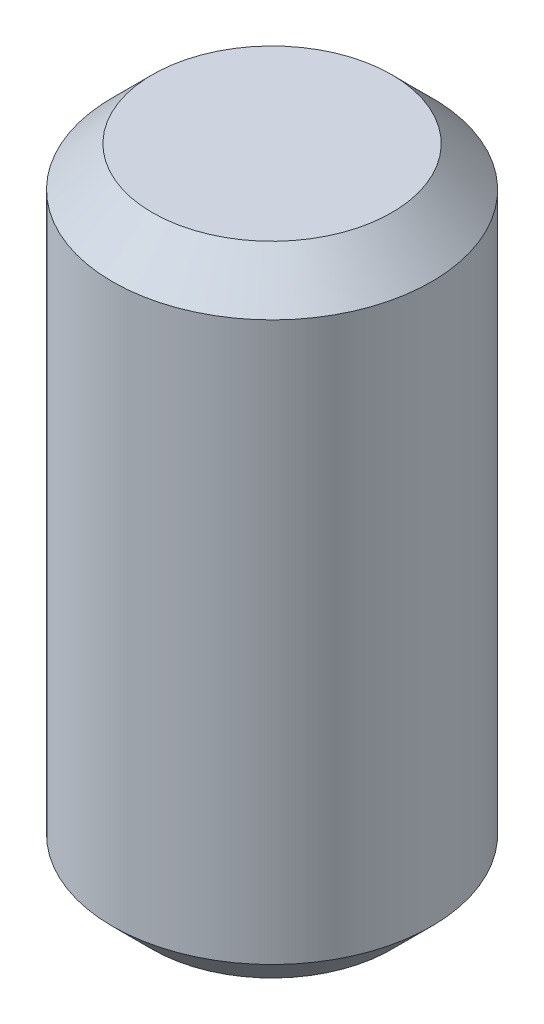
from build123d import *

# Parameters (mm, degrees)
SKETCH1_R           = 2
BOSS_EXTRUDE1_DEPTH = 8
CHAMFER1_SIZE       = 0.5


with BuildPart() as part:
    # Sketch1 → Boss-Extrude1 (new body)
    with BuildSketch(Plane(origin=(0, 0, 0), x_dir=(1, 0, 0), z_dir=(0, 1, 0))):
        with Locations(Location((0, 0, 0), (0, 0, 270))):
            Circle(SKETCH1_R)
    extrude(amount=BOSS_EXTRUDE1_DEPTH)

    # Chamfer1
    chamfer1_edges = [part.edges().sort_by_distance(p)[0] for p in [
        (0, 0, -2),
        (0, 8, -2),
    ]]
    chamfer(chamfer1_edges, length=CHAMFER1_SIZE)


solid = part.part
